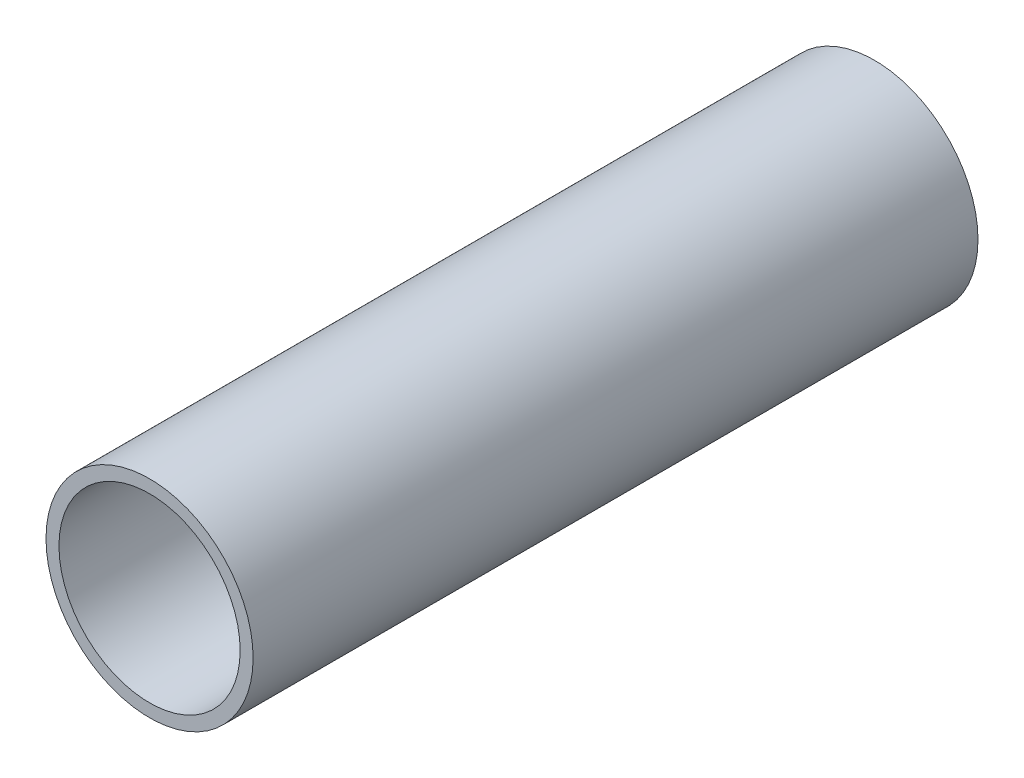
from build123d import *

# Parameters (mm, degrees)
SKETCH3_R           = 50.8
SKETCH3_R_2         = 44.45
BOSS_EXTRUDE1_DEPTH = 177.8


with BuildPart() as part:
    # Sketch3 → Boss-Extrude1 (new, symmetric)
    with BuildSketch(Plane.XY):
        Circle(SKETCH3_R)
        Circle(SKETCH3_R_2, mode=Mode.SUBTRACT)
    extrude(amount=BOSS_EXTRUDE1_DEPTH, both=True)


solid = part.part
